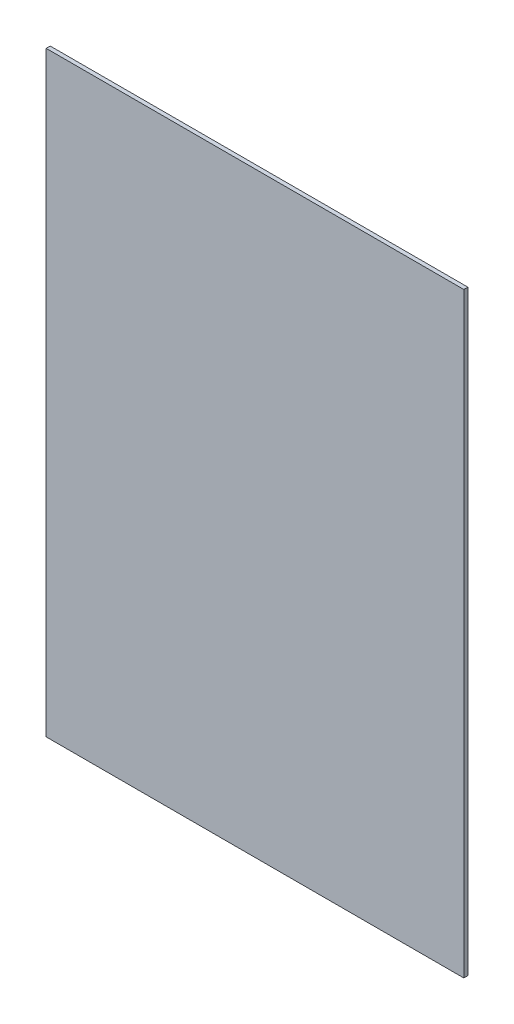
from build123d import *

# Parameters (mm, degrees)
SKETCH1_W           = 206.622469386
SKETCH1_H           = 295
BOSS_EXTRUDE1_DEPTH = 2


with BuildPart() as part:
    # Sketch1 → Boss-Extrude1 (new body)
    with BuildSketch(Plane.XY):
        with Locations((111.540347252, -147.5)):
            Rectangle(SKETCH1_W, SKETCH1_H)
    extrude(amount=BOSS_EXTRUDE1_DEPTH)


solid = part.part
